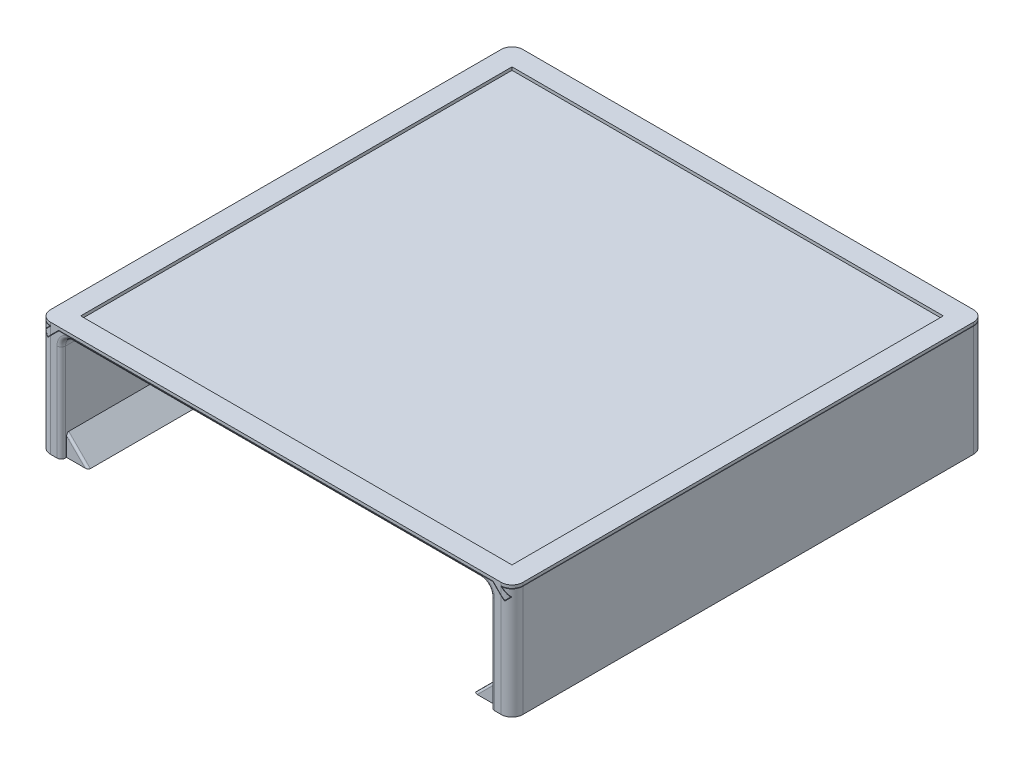
from build123d import *

# Parameters (mm, degrees)
BOSS_EXTRUDE1_DEPTH  = 109.5
BOSS_EXTRUDE2_DEPTH  = 109.5
SKETCH2_W            = 200
SKETCH2_H            = 200
CUT_EXTRUDE1_DEPTH   = 164.258659801
FILLET1_R            = 5
SKETCH3_W            = 199
SKETCH3_H            = 50
BOSS_EXTRUDE3_DEPTH  = 5
FILLET2_R            = 5
SKETCH9_W            = 379
SKETCH9_H            = 379
CUT_EXTRUDE3_DEPTH   = 164.707391403
FILLET4_R            = 2
FILLET5_R            = 1
BOSS_EXTRUDE6_DEPTH  = 107
FILLET6_R            = 1
FILLET6_OF_MIRROR1_R = 1
CUT_EXTRUDE4_DEPTH   = 2


with BuildPart() as part:
    # Sketch1 → Boss-Extrude1 (new, symmetric)
    with BuildSketch(Plane.XY):
        Polygon((-99.5, -1.5), (99.5, -1.5), (99.5, -51.5), (109.5, -51.5), (109.5, 0), (104.717157288, 0), (108, -3.282842712), (105.949390335, -5.333452378), (100.615937957, 0), (-100.615937957, 0), (-105.949390335, -5.333452378), (-108, -3.282842712), (-104.717157288, 0), (-109.5, 0), (-109.5, -51.5), (-99.5, -51.5), align=None)
    extrude(amount=BOSS_EXTRUDE1_DEPTH, both=True)

    # Fillet1
    fillet1_edges = [part.edges().sort_by_distance(p)[0] for p in [
        (99.5, -1.5, 0),
        (-99.5, -1.5, 0),
    ]]
    fillet(fillet1_edges, radius=FILLET1_R)

    # Sketch3 → Boss-Extrude3 (add, symmetric)
    with BuildSketch(Plane.XY):
        with Locations((0, -26.5)):
            Rectangle(SKETCH3_W, SKETCH3_H)
    extrude(amount=BOSS_EXTRUDE3_DEPTH, both=True)

    # Fillet2
    fillet2_edges = [part.edges().sort_by_distance(p)[0] for p in [
        (-109.5, -25.75, 109.5),
        (-109.5, -25.75, -109.5),
        (109.5, -25.75, -109.5),
        (109.5, -25.75, 109.5),
    ]]
    fillet(fillet2_edges, radius=FILLET2_R)

    # Fillet4
    fillet4_edges = [part.edges().sort_by_distance(p)[0] for p in [
        (-99.5, -29, 109.5),
        (-98.035533906, -2.964466094, 109.5),
        (99.5, -29, 109.5),
        (98.035533906, -2.964466094, 109.5),
        (-99.5, -29, -109.5),
        (-98.035533906, -2.964466094, -109.5),
        (99.5, -29, -109.5),
        (98.035533906, -2.964466094, -109.5),
        (0, -1.5, 109.5),
        (0, -1.5, -109.5),
    ]]
    fillet(fillet4_edges, radius=FILLET4_R)

    # Fillet5
    fillet5_edges = [part.edges().sort_by_distance(p)[0] for p in [
        (-99.5, -29, -5),
        (-98.035533906, -2.964466094, -5),
        (0, -1.5, -5),
        (98.035533906, -2.964466094, -5),
        (-99.5, -29, 5),
        (-98.035533906, -2.964466094, 5),
        (0, -1.5, 5),
        (98.035533906, -2.964466094, 5),
        (99.5, -29, -5),
        (99.5, -29, 5),
    ]]
    fillet(fillet5_edges, radius=FILLET5_R)

    # Sketch6 → Boss-Extrude6 (add, symmetric)
    with BuildSketch(Plane.XY):
        Polygon((-99.5, -51.5), (-89.5, -51.5), (-99.5, -41.5), align=None)
    boss_extrude6 = extrude(amount=BOSS_EXTRUDE6_DEPTH, both=True)

    # Fillet6
    fillet6_edges = [part.edges().sort_by_distance(p)[0] for p in [
        (-94.5, -46.5, 107),
        (-94.5, -46.5, -107),
    ]]
    fillet(fillet6_edges, radius=FILLET6_R)

    # Mirror1: Boss-Extrude6 across plane
    add(boss_extrude6.mirror(Plane(origin=(0, 0, 0), x_dir=(0, 0, 1), z_dir=(1, 0, 0))))

    # Fillet6 of Mirror1
    fillet6_of_mirror1_edges = [part.edges().sort_by_distance(p)[0] for p in [
        (94.5, -46.5, 107),
        (94.5, -46.5, -107),
    ]]
    fillet(fillet6_of_mirror1_edges, radius=FILLET6_OF_MIRROR1_R)

    # Sketch10 → Cut-Extrude4 (cut, symmetric)
    with BuildSketch(Plane.XY):
        with BuildLine():
            Line((10, -17), (-10, -17))
            Line((-10, -17), (-10, -27))
            ThreePointArc((-10, -27), (0, -37), (10, -27))
            Line((10, -27), (10, -17))
        make_face()
    extrude(amount=CUT_EXTRUDE4_DEPTH, both=True, mode=Mode.SUBTRACT)


with BuildPart() as body_2:
    # Sketch1<4> → Boss-Extrude2 (new, symmetric)
    with BuildSketch(Plane.XY):
        Polygon((-109.5, 0.2), (-104.234314575, 0.2), (-107.717157288, -3.282842712), (-105.949390335, -5.050609665), (-100.698780669, 0.2), (100.698780669, 0.2), (105.949390335, -5.050609665), (107.717157288, -3.282842712), (104.234314575, 0.2), (109.5, 0.2), (109.5, 1.6), (-109.5, 1.6), align=None)
    extrude(amount=BOSS_EXTRUDE2_DEPTH, both=True)

    # Sketch2 → Cut-Extrude1 (cut, through all)
    with BuildSketch(Plane.XZ.offset(-0.2)):
        Rectangle(SKETCH2_W, SKETCH2_H)
    extrude(amount=-CUT_EXTRUDE1_DEPTH, mode=Mode.SUBTRACT)

    # Sketch9 → Cut-Extrude3 (cut, through all)
    with BuildSketch(Plane.XZ.offset(51.5)):
        Rectangle(SKETCH9_W, SKETCH9_H)
        with BuildLine():
            ThreePointArc((109.5, -104.5), (108.035533906, -108.035533906), (104.5, -109.5))
            Line((104.5, -109.5), (99.5, -109.5))
            Line((99.5, -109.5), (-99.5, -109.5))
            Line((-99.5, -109.5), (-104.5, -109.5))
            ThreePointArc((-104.5, -109.5), (-108.035533906, -108.035533906), (-109.5, -104.5))
            Line((-109.5, -104.5), (-109.5, 104.5))
            ThreePointArc((-109.5, 104.5), (-108.035533906, 108.035533906), (-104.5, 109.5))
            Line((-104.5, 109.5), (-99.5, 109.5))
            Line((-99.5, 109.5), (99.5, 109.5))
            Line((99.5, 109.5), (104.5, 109.5))
            ThreePointArc((104.5, 109.5), (108.035533906, 108.035533906), (109.5, 104.5))
            Line((109.5, 104.5), (109.5, -104.5))
        make_face(mode=Mode.SUBTRACT)
    extrude(amount=-CUT_EXTRUDE3_DEPTH, mode=Mode.SUBTRACT)


solid = Compound([part.part, body_2.part])
